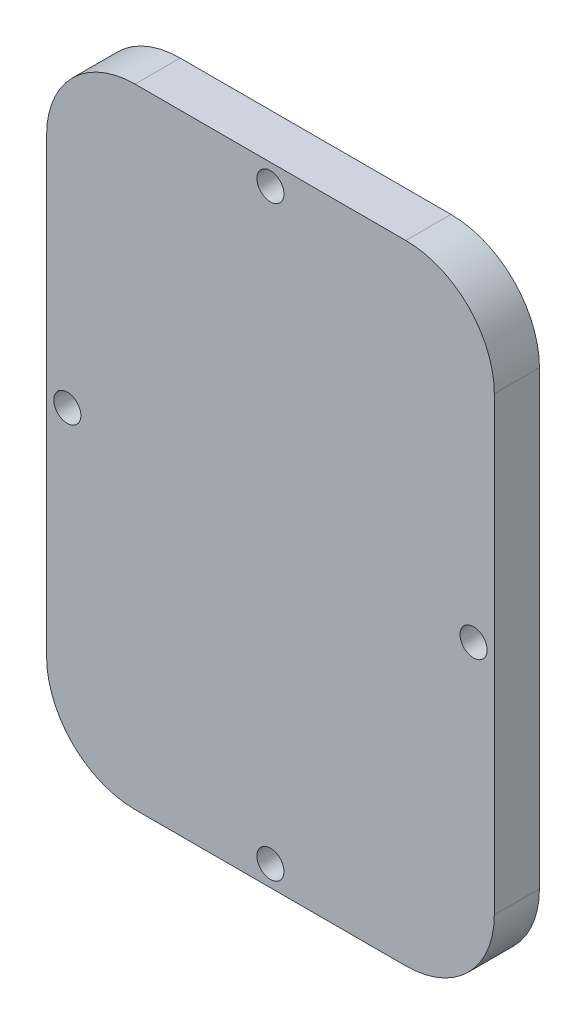
from build123d import *

# Parameters (mm, degrees)
ESBO_O1_R                = 1.5
RESSALTO_EXTRUS_O1_DEPTH = 5


with BuildPart() as part:
    # Esboço1 → Ressalto-extrusão1 (new body)
    with BuildSketch(Plane.XY):
        with BuildLine():
            Line((24.8, -25), (24.8, 25))
            ThreePointArc((24.8, 25), (21.929646456, 31.929646456), (15, 34.8))
            Line((15, 34.8), (-15, 34.8))
            ThreePointArc((-15, 34.8), (-21.929646456, 31.929646456), (-24.8, 25))
            Line((-24.8, 25), (-24.8, -25))
            ThreePointArc((-24.8, -25), (-21.929646456, -31.929646456), (-15, -34.8))
            Line((-15, -34.8), (15, -34.8))
            ThreePointArc((15, -34.8), (21.929646456, -31.929646456), (24.8, -25))
        make_face()
        with Locations((0, -32.5)):
            Circle(ESBO_O1_R, mode=Mode.SUBTRACT)
        with Locations((22.5, 0)):
            Circle(ESBO_O1_R, mode=Mode.SUBTRACT)
        with Locations((0, 32.5)):
            Circle(ESBO_O1_R, mode=Mode.SUBTRACT)
        with Locations((-22.5, 0)):
            Circle(ESBO_O1_R, mode=Mode.SUBTRACT)
    extrude(amount=RESSALTO_EXTRUS_O1_DEPTH)


solid = part.part
